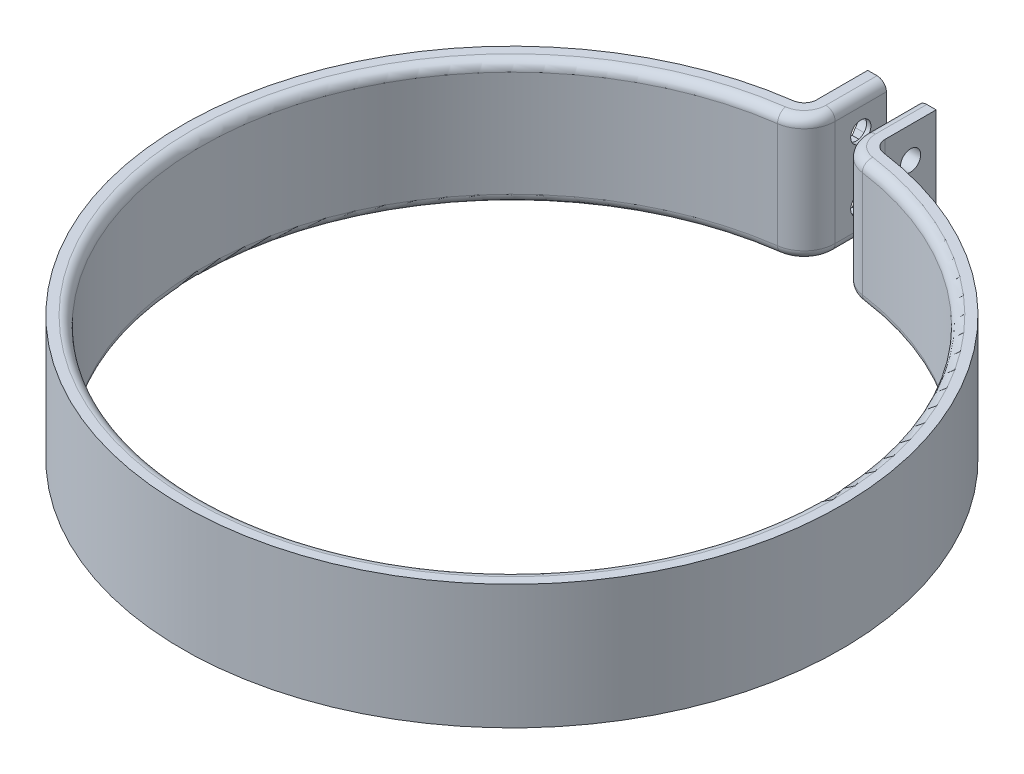
from build123d import *

# Parameters (mm, degrees)
BOSS_EXTRUDE1_DEPTH = 20
FILLET1_R           = 5
FILLET2_R           = 2
FILLET3_R           = 1.5
SKETCH4_R           = 2.9
CUT_EXTRUDE3_DEPTH  = 2
SKETCH5_R           = 1.625
CUT_EXTRUDE4_DEPTH  = 89.064050596
CUT_EXTRUDE5_DEPTH  = 2.3


with BuildPart() as part:
    # Sketch1 → Boss-Extrude1 (new body)
    with BuildSketch(Plane(origin=(0, 0, 0), x_dir=(1, 0, 0), z_dir=(0, 1, 0))):
        with BuildLine():
            Line((2.5, 62.713850172), (5.5, 62.713850172))
            Line((5.5, 62.713850172), (5.5, 52.713850172))
            ThreePointArc((5.5, 52.713850172), (0, -53), (-5.5, 52.713850172))
            Line((-5.5, 52.713850172), (-5.5, 62.713850172))
            Line((-5.5, 62.713850172), (-2.5, 62.713850172))
            Line((-2.5, 62.713850172), (-2.5, 49.937460889))
            ThreePointArc((-2.5, 49.937460889), (0, -50), (2.5, 49.937460889))
            Line((2.5, 49.937460889), (2.5, 62.713850172))
        make_face()
    extrude(amount=BOSS_EXTRUDE1_DEPTH)

    # Fillet1
    fillet1_edges = [part.edges().sort_by_distance(p)[0] for p in [
        (-2.5, 10, -49.937460889),
        (2.5, 10, -49.937460889),
    ]]
    fillet(fillet1_edges, radius=FILLET1_R)

    # Fillet2
    fillet2_edges = [part.edges().sort_by_distance(p)[0] for p in [
        (5.5, 10, -52.713850172),
        (-5.5, 10, -52.713850172),
    ]]
    fillet(fillet2_edges, radius=FILLET2_R)

    # Fillet3
    fillet3_edges = [part.edges().sort_by_distance(p)[0] for p in [
        (2.5, 0, -58.600043483),
        (0, 0, 50),
        (0, 20, 50),
        (-2.5, 0, -58.600043483),
        (-3.731108193, 0, -51.200593091),
        (3.731108193, 0, -51.200593091),
        (-2.5, 20, -58.600043483),
        (-3.731108193, 20, -51.200593091),
        (3.731108193, 20, -51.200593091),
        (2.5, 20, -58.600043483),
    ]]
    fillet(fillet3_edges, radius=FILLET3_R)

    # Sketch4 → Cut-Extrude3 (cut)
    with BuildSketch(Plane.ZY.offset(5.5)):
        with Locations((-58.600043483, 15)):
            Circle(SKETCH4_R)
        with Locations((-58.600043483, 5)):
            Circle(SKETCH4_R)
    extrude(amount=-CUT_EXTRUDE3_DEPTH, mode=Mode.SUBTRACT)

    # Sketch5 → Cut-Extrude4 (cut, through all)
    with BuildSketch(Plane.ZY.offset(5.5)):
        with Locations((-58.600043483, 15)):
            Circle(SKETCH5_R)
        with Locations((-58.600043483, 5)):
            Circle(SKETCH5_R)
    extrude(amount=-CUT_EXTRUDE4_DEPTH, mode=Mode.SUBTRACT)

    # Sketch6 → Cut-Extrude5 (cut)
    with BuildSketch(Plane.ZY.offset(5.5)):
        Polygon((-55.338014462, 15), (-56.969028973, 17.825), (-60.231057994, 17.825), (-61.862072504, 15), (-60.231057994, 12.175), (-56.969028973, 12.175), align=None)
        Polygon((-55.338014462, 5), (-56.969028973, 7.825), (-60.231057994, 7.825), (-61.862072504, 5), (-60.231057994, 2.175), (-56.969028973, 2.175), align=None)
    extrude(amount=-CUT_EXTRUDE5_DEPTH, mode=Mode.SUBTRACT)


solid = part.part
